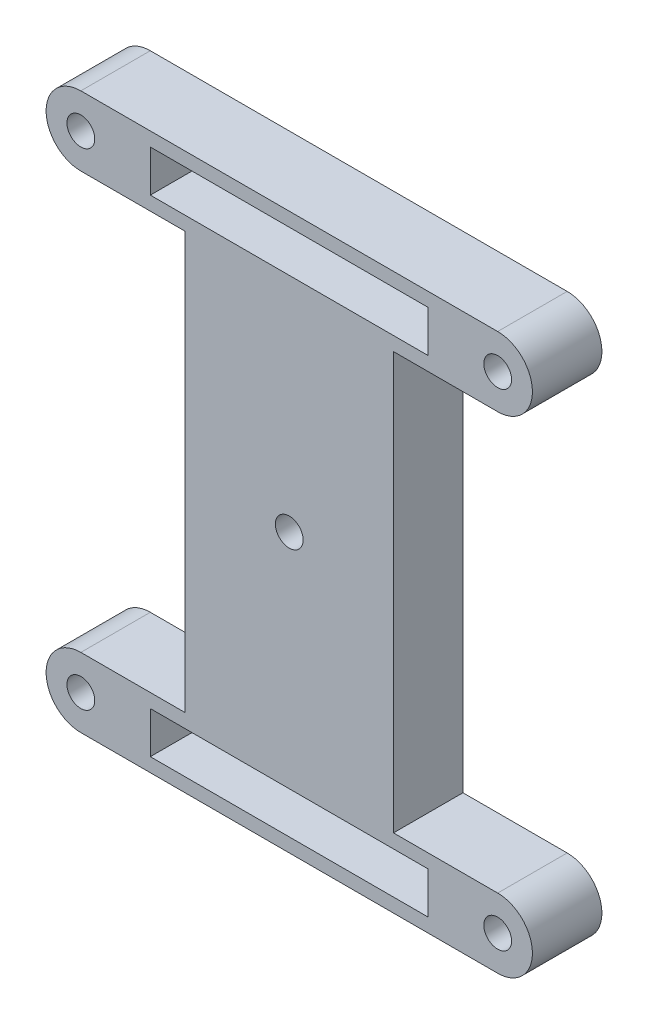
from build123d import *

# Parameters (mm, degrees)
SKETCH1_R           = 1
BOSS_EXTRUDE2_DEPTH = 2.5
SKETCH2_R           = 1
SKETCH2_W           = 20
SKETCH2_H           = 3
CUT_EXTRUDE1_DEPTH  = 28.041634566


with BuildPart() as part:
    # Sketch1 → Boss-Extrude2 (new, symmetric)
    with BuildSketch(Plane.XY):
        with BuildLine():
            Line((7.5, 15), (15, 15))
            ThreePointArc((15, 15), (17.5, 17.5), (15, 20))
            Line((15, 20), (-15, 20))
            ThreePointArc((-15, 20), (-17.5, 17.5), (-15, 15))
            Line((-15, 15), (-7.5, 15))
            Line((-7.5, 15), (-7.5, -15))
            Line((-7.5, -15), (-15, -15))
            ThreePointArc((-15, -15), (-17.5, -17.5), (-15, -20))
            Line((-15, -20), (15, -20))
            ThreePointArc((15, -20), (17.5, -17.5), (15, -15))
            Line((15, -15), (7.5, -15))
            Line((7.5, -15), (7.5, 15))
        make_face()
        with Locations((-15, 17.5)):
            Circle(SKETCH1_R, mode=Mode.SUBTRACT)
        with Locations((15, 17.5)):
            Circle(SKETCH1_R, mode=Mode.SUBTRACT)
        with Locations(Location((15, -17.5, 0), (0, 0, 180))):
            Circle(SKETCH1_R, mode=Mode.SUBTRACT)
        with Locations(Location((-15, -17.5, 0), (0, 0, 180))):
            Circle(SKETCH1_R, mode=Mode.SUBTRACT)
    extrude(amount=BOSS_EXTRUDE2_DEPTH, both=True)

    # Sketch2 → Cut-Extrude1 (cut, through all)
    with BuildSketch(Plane.XY.offset(2.5)):
        Circle(SKETCH2_R)
        with Locations((0, 17.5)):
            Rectangle(SKETCH2_W, SKETCH2_H)
        with Locations((0, -17.5)):
            Rectangle(SKETCH2_W, SKETCH2_H)
    extrude(amount=-CUT_EXTRUDE1_DEPTH, mode=Mode.SUBTRACT)


solid = part.part
